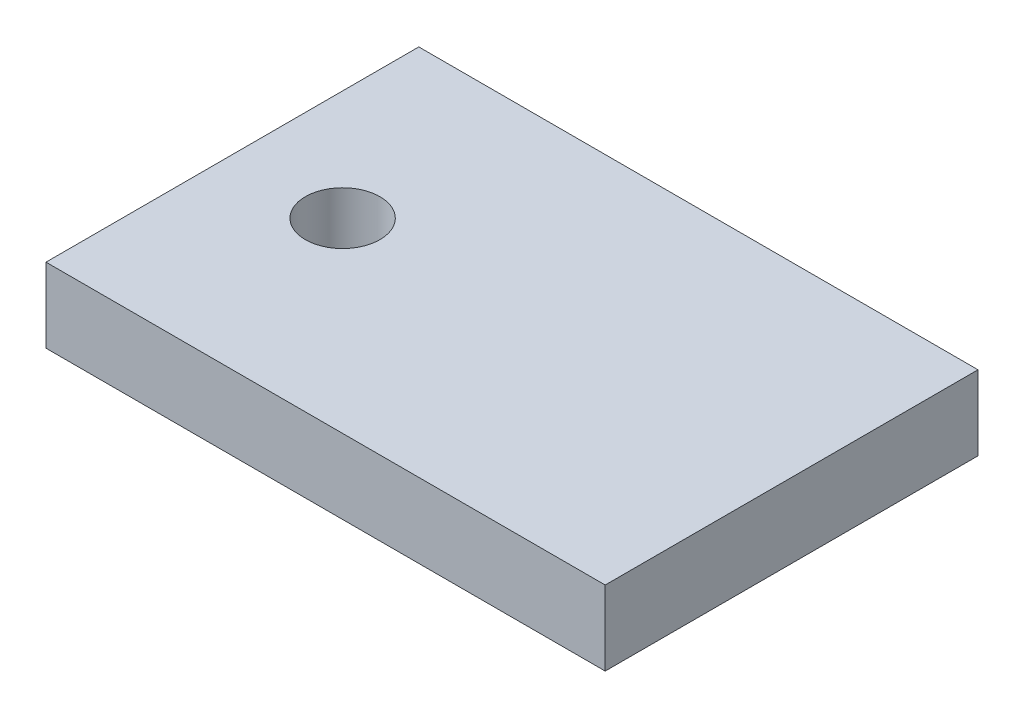
from build123d import *

# Parameters (mm, degrees)
SKETCH_1_W          = 30
SKETCH_1_H          = 6
EXTRUDE_1_DEPTH     = 45
SKETCH_2_R          = 3
CUT_EXTRUDE_1_DEPTH = 55.415071442


with BuildPart() as part:
    # Эскиз1 → Вытянуть1 (new body)
    with BuildSketch(Plane(origin=(0, 0, 0), x_dir=(0, 0, -1), z_dir=(1, 0, 0))):
        with Locations((15, -3)):
            Rectangle(SKETCH_1_W, SKETCH_1_H)
    extrude(amount=EXTRUDE_1_DEPTH)

    # Эскиз2 → Вырез-Вытянуть1 (cut, through all)
    with BuildSketch(Plane(origin=(0, 0, 0), x_dir=(-1, 0, 0), z_dir=(0, 1, 0))):
        with Locations(Location((-8.86993337, -14.999999492, 0), (0, 0, 90))):
            Circle(SKETCH_2_R)
    extrude(amount=-CUT_EXTRUDE_1_DEPTH, mode=Mode.SUBTRACT)


solid = part.part
